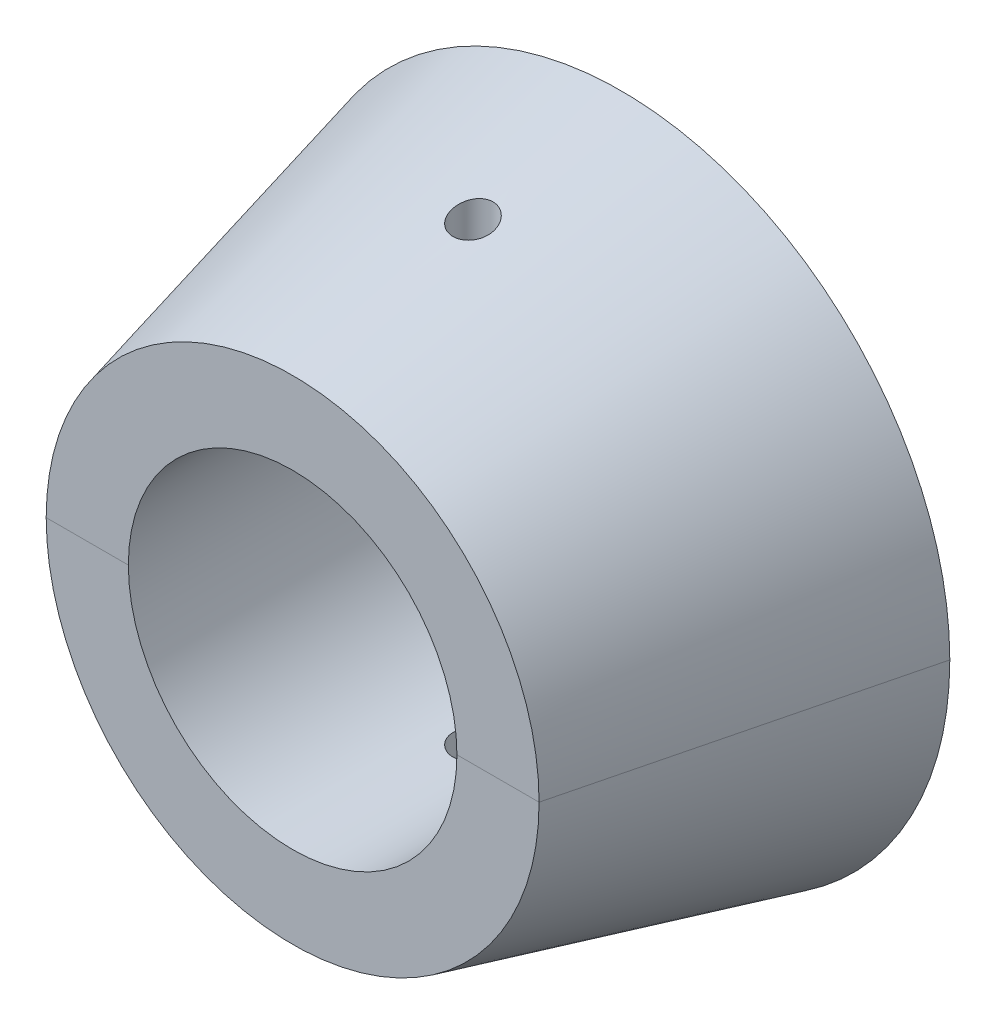
from build123d import *

# Parameters (mm, degrees)
SKETCH1_R                                         = 12.5
BOSS_EXTRUDE1_DEPTH                               = 5
SKETCH4_R                                         = 10
CUT_EXTRUDE1_DEPTH                                = 20
CUT_EXTRUDE2_START                                = -16.25
CUT_EXTRUDE2_DEPTH                                = 5
CSK_FOR_2_FLAT_HEAD_MACHINE_SCREW_100_D           = 2.4384
CSK_FOR_2_FLAT_HEAD_MACHINE_SCREW_100_CSINK_D     = 4.3688
CSK_FOR_2_FLAT_HEAD_MACHINE_SCREW_100_CSINK_ANGLE = 100


with BuildPart() as part:
    # Sketch1 → Boss-Extrude1 (new body)
    with BuildSketch(Plane.XY):
        Circle(SKETCH1_R)
    extrude(amount=BOSS_EXTRUDE1_DEPTH)

    # Sweep1: sweep along a curve in space
    with BuildLine() as sweep1_path:
        ThreePointArc((12.5, 0, 5), (8.838834765, 8.838834765, 5), (0, 12.5, 5))
        ThreePointArc((0, 12.5, 5), (-8.838834765, 8.838834765, 5), (-12.5, 0, 5))
        ThreePointArc((-12.5, 0, 5), (-8.838834765, -8.838834765, 5), (0, -12.5, 5))
        ThreePointArc((0, -12.5, 5), (8.838834765, -8.838834765, 5), (12.5, 0, 5))
    # Sketch3 → Sweep1 (sweep)
    with BuildSketch(Plane(origin=(0, 0, 0), x_dir=(1, 0, 0), z_dir=(0, 1, 0))):
        Polygon((0, -5), (-20, -5), (-15, -25), (0, -25), align=None)
    sweep(path=sweep1_path.line)

    # Sketch4 → Cut-Extrude1 (cut)
    with BuildSketch(Plane.XY.offset(25)):
        Circle(SKETCH4_R)
    extrude(amount=-CUT_EXTRUDE1_DEPTH, mode=Mode.SUBTRACT)

    # Sketch11 → Cut-Extrude2 (cut)
    with BuildSketch(Plane(origin=(0, 0, 0), x_dir=(1, 0, 0), z_dir=(0, 1, 0)).offset(CUT_EXTRUDE2_START)):
        with BuildLine():
            Line((-3, -10), (3, -10))
            Line((3, -10), (3, -14))
            ThreePointArc((3, -14), (0, -17), (-3, -14))
            Line((-3, -14), (-3, -10))
        make_face()
    extrude(amount=-CUT_EXTRUDE2_DEPTH, mode=Mode.SUBTRACT)

    # CSK for #2 Flat Head Machine Screw (100)2 (through all)
    with Locations(Plane(origin=(0, -16.25, 14.023346871), x_dir=(0, 0, -1), z_dir=(0, -1, 0))):
        with Locations((0, 0)):
            CounterSinkHole(CSK_FOR_2_FLAT_HEAD_MACHINE_SCREW_100_D / 2, CSK_FOR_2_FLAT_HEAD_MACHINE_SCREW_100_CSINK_D / 2, counter_sink_angle=CSK_FOR_2_FLAT_HEAD_MACHINE_SCREW_100_CSINK_ANGLE)


solid = part.part
